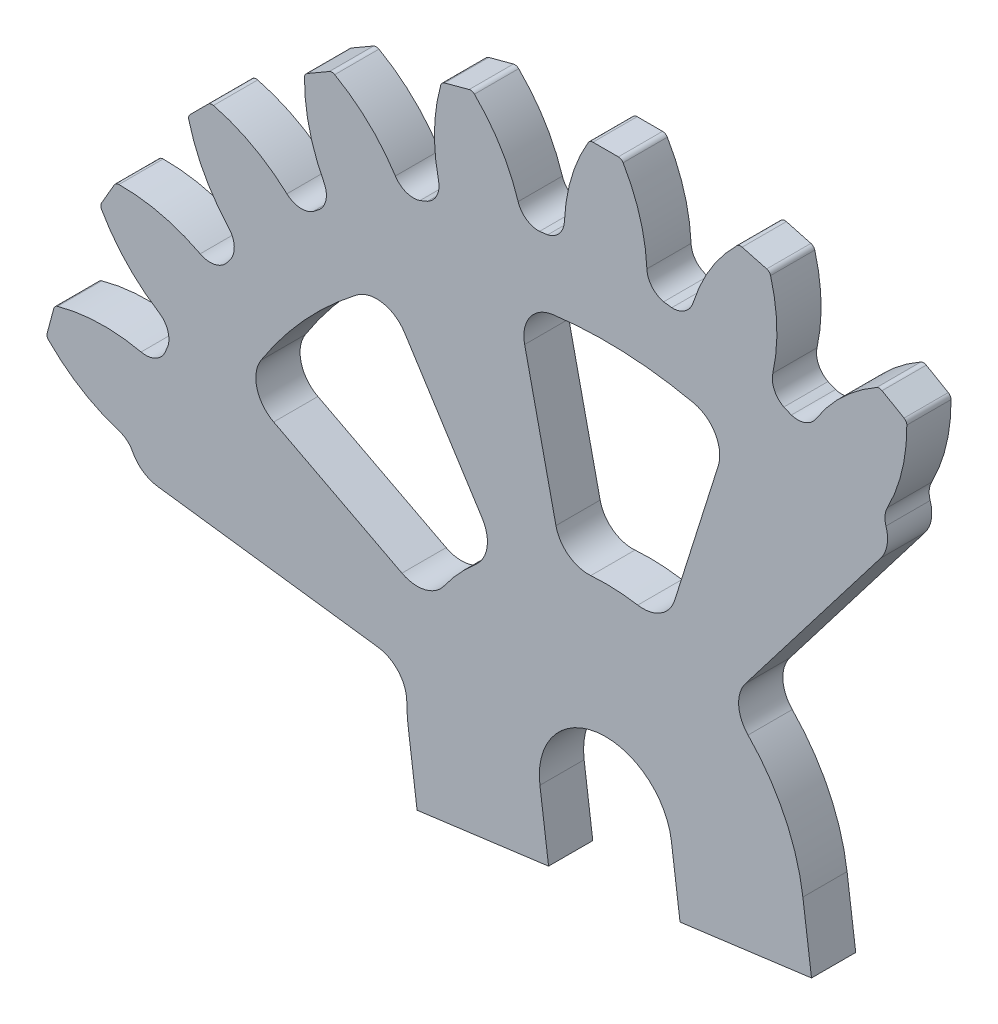
from build123d import *

# Parameters (mm, degrees)
SKETCH3_R                = 136.611351841
EXTRUDE1_DEPTH           = 12.7
EXTRUDE2_DEPTH           = 12.7
FILLET2_R                = 1.5875
CIRPATTERN1_COUNT        = 24
FILLET2_OF_CIRPATTERN1_R = 1.5875
CUT_EXTRUDE1_DEPTH       = 234.890969431
CUT_EXTRUDE1_DEPTH_BACK  = 234.890969431
CUT_EXTRUDE2_REACH       = 232.646
SKETCH5_R                = 19.05
EXTRUDE3_DEPTH           = 12.7
CUT_EXTRUDE5_DEPTH       = 231.646456089
FILLET1_R                = 9.525
CUT_EXTRUDE7_DEPTH       = 12.7


with BuildPart() as part:
    # Sketch3 → Extrude1 (new body)
    with BuildSketch(Plane.XY):
        Circle(SKETCH3_R)
    extrude(amount=EXTRUDE1_DEPTH)

    # Sketch2 → Extrude2 (add)
    with BuildSketch(Plane.XY):
        with BuildLine():
            Line((-4.546074008, 165.141901983), (4.546074008, 165.141901983))
            ThreePointArc((4.546074008, 165.141901983), (9.719017906, 153.717756782), (11.846410355, 141.35876639))
            ThreePointArc((11.846410355, 141.35876639), (13.677789854, 137.226095775), (17.83135957, 135.442622788))
            Line((17.83135957, 135.442622788), (17.83135957, 110.042622788))
            Line((17.83135957, 110.042622788), (-17.83135957, 110.042622788))
            Line((-17.83135957, 110.042622788), (-17.83135957, 135.442622788))
            ThreePointArc((-17.83135957, 135.442622788), (-13.677789854, 137.226095775), (-11.846410355, 141.35876639))
            ThreePointArc((-11.846410355, 141.35876639), (-9.719017906, 153.717756782), (-4.546074008, 165.141901983))
        make_face()
    extrude2 = extrude(amount=EXTRUDE2_DEPTH)

    # Fillet2
    fillet2_edges = [part.edges().sort_by_distance(p)[0] for p in [
        (4.546074008, 165.141901983, 6.35),
        (-4.546074008, 165.141901983, 6.35),
    ]]
    fillet(fillet2_edges, radius=FILLET2_R)

    # CirPattern1: Extrude2 ×24 about axis
    cirpattern1_axis = Axis((0, 0, 0), (0, 0, 1))
    for i in range(1, CIRPATTERN1_COUNT):
        add(extrude2.rotate(cirpattern1_axis, i * 360 / CIRPATTERN1_COUNT))

    # Fillet2 of CirPattern1
    fillet2_of_cirpattern1_edges = [part.edges().sort_by_distance(p)[0] for p in [
        (-38.350699085, 160.691438662, 6.35),
        (-47.13303967, 158.338217595, 6.35),
        (-78.633935413, 145.290119351, 6.35),
        (-86.50796657, 140.744045343, 6.35),
        (-113.558398992, 119.987518509, 6.35),
        (-119.987518509, 113.558398992, 6.35),
        (-140.744045343, 86.50796657, 6.35),
        (-145.290119351, 78.633935413, 6.35),
        (-158.338217595, 47.13303967, 6.35),
        (-160.691438662, 38.350699085, 6.35),
        (-165.141901983, 4.546074008, 6.35),
        (-165.141901983, -4.546074008, 6.35),
        (-160.691438662, -38.350699085, 6.35),
        (-158.338217595, -47.13303967, 6.35),
        (-145.290119351, -78.633935413, 6.35),
        (-140.744045343, -86.50796657, 6.35),
        (-119.987518509, -113.558398992, 6.35),
        (-113.558398992, -119.987518509, 6.35),
        (-86.50796657, -140.744045343, 6.35),
        (-78.633935413, -145.290119351, 6.35),
        (-47.13303967, -158.338217595, 6.35),
        (-38.350699085, -160.691438662, 6.35),
        (-4.546074008, -165.141901983, 6.35),
        (4.546074008, -165.141901983, 6.35),
        (38.350699085, -160.691438662, 6.35),
        (47.13303967, -158.338217595, 6.35),
        (78.633935413, -145.290119351, 6.35),
        (86.50796657, -140.744045343, 6.35),
        (113.558398992, -119.987518509, 6.35),
        (119.987518509, -113.558398992, 6.35),
        (140.744045343, -86.50796657, 6.35),
        (145.290119351, -78.633935413, 6.35),
        (158.338217595, -47.13303967, 6.35),
        (160.691438662, -38.350699085, 6.35),
        (165.141901983, -4.546074008, 6.35),
        (165.141901983, 4.546074008, 6.35),
        (160.691438662, 38.350699085, 6.35),
        (158.338217595, 47.13303967, 6.35),
        (145.290119351, 78.633935413, 6.35),
        (140.744045343, 86.50796657, 6.35),
        (119.987518509, 113.558398992, 6.35),
        (113.558398992, 119.987518509, 6.35),
        (86.50796657, 140.744045343, 6.35),
        (78.633935413, 145.290119351, 6.35),
        (47.13303967, 158.338217595, 6.35),
        (38.350699085, 160.691438662, 6.35),
    ]]
    fillet(fillet2_of_cirpattern1_edges, radius=FILLET2_OF_CIRPATTERN1_R)

    # Sketch4 → Cut-Extrude1 (cut, two sides: drawn at the far end of the back side and taken through both)
    with BuildSketch(Plane.XY.offset(-CUT_EXTRUDE1_DEPTH_BACK)):
        Polygon((-1275.53694573, 167.92762467), (-268.218413087, 35.311623982), (0, 0), (164.689969961, 214.628147505), (783.198061827, 1020.683586133), (1560.818943381, -856.6592925), (-497.916064176, -1709.415253962), align=None)
    extrude(amount=CUT_EXTRUDE1_DEPTH + CUT_EXTRUDE1_DEPTH_BACK, mode=Mode.SUBTRACT)

    # Sketch5 → Cut-Extrude2 (cut, up to next)
    with BuildSketch(Plane.XY, mode=Mode.PRIVATE) as cut_extrude2_sk1:
        Circle(SKETCH5_R)
    cut_extrude2_tool1 = extrude(cut_extrude2_sk1.sketch, amount=CUT_EXTRUDE2_REACH, mode=Mode.PRIVATE) & part.part
    add(cut_extrude2_tool1.solids().sort_by_distance((0, 0, 0))[0], mode=Mode.SUBTRACT)

    # Sketch6 → Extrude3 (add)
    with BuildSketch(Plane.XY):
        with BuildLine():
            Line((-18.887024609, -2.486523962), (-16.400500647, -21.373548571))
            Line((-16.400500647, -21.373548571), (-54.174549866, -26.346596495))
            Line((-54.174549866, -26.346596495), (-56.661073828, -7.459571885))
            ThreePointArc((-56.661073828, -7.459571885), (-57.15, 0), (-56.661073828, 7.459571885))
            Line((-56.661073828, 7.459571885), (-18.887024609, 2.486523962))
            ThreePointArc((-18.887024609, 2.486523962), (-19.05, 0), (-18.887024609, -2.486523962))
        make_face()
        with BuildLine():
            Line((11.596905223, 15.113381133), (34.790715668, 45.340143398))
            ThreePointArc((34.790715668, 45.340143398), (49.493351826, 28.575), (56.661073828, 7.459571885))
            Line((56.661073828, 7.459571885), (59.147597789, -11.427452724))
            Line((59.147597789, -11.427452724), (21.373548571, -16.400500647))
            Line((21.373548571, -16.400500647), (18.887024609, 2.486523962))
            ThreePointArc((18.887024609, 2.486523962), (16.497783942, 9.525), (11.596905223, 15.113381133))
        make_face()
    extrude(amount=EXTRUDE3_DEPTH)

    # Sketch8 → Cut-Extrude5 (cut, through all)
    with BuildSketch(Plane.XY):
        with BuildLine():
            Line((-25.426243647, 114.690373436), (-12.369523937, 55.795316807))
            ThreePointArc((-12.369523937, 55.795316807), (2.492847988, 57.095605863), (17.185336442, 54.504923735))
            Line((17.185336442, 54.504923735), (35.325413797, 112.037898789))
            ThreePointArc((35.325413797, 112.037898789), (5.124187531, 117.36318983), (-25.426243647, 114.690373436))
        make_face()
        with BuildLine():
            Line((-63.119271491, 99.077410097), (-30.706672617, 48.199821128))
            ThreePointArc((-30.706672617, 48.199821128), (-42.135399799, 38.609980365), (-50.692669116, 26.388933246))
            Line((-50.692669116, 26.388933246), (-104.201597628, 54.24391834))
            ThreePointArc((-104.201597628, 54.24391834), (-86.611655142, 79.36495964), (-63.119271491, 99.077410097))
        make_face()
    extrude(amount=CUT_EXTRUDE5_DEPTH, mode=Mode.SUBTRACT)

    # Fillet1
    fillet1_edges = [part.edges().sort_by_distance(p)[0] for p in [
        (34.790715668, 45.340143398, 6.35),
        (-50.692669116, 26.388933246, 6.35),
        (-30.706672617, 48.199821128, 6.35),
        (-63.119271491, 99.077410097, 6.35),
        (-104.201597628, 54.24391834, 6.35),
        (-12.369523937, 55.795316807, 6.35),
        (17.185336442, 54.504923735, 6.35),
        (35.325413797, 112.037898789, 6.35),
        (-25.426243647, 114.690373436, 6.35),
        (-56.661073828, 7.459571885, 6.35),
    ]]
    fillet(fillet1_edges, radius=FILLET1_R)

    # Sketch9 → Cut-Extrude7 (cut)
    with BuildSketch(Plane.XY):
        with BuildLine():
            Line((79.034097122, 102.999240689), (83.809524096, 109.222698287))
            Line((83.809524096, 109.222698287), (80.539107883, 111.732176909))
            ThreePointArc((80.539107883, 111.732176909), (80.864034333, 107.180027092), (79.034097122, 102.999240689))
        make_face()
        with BuildLine():
            Line((-128.717007568, 16.945915528), (-136.494393434, 17.969827802))
            Line((-136.494393434, 17.969827802), (-135.956329304, 22.056830634))
            ThreePointArc((-135.956329304, 22.056830634), (-132.967230996, 18.608216933), (-128.717007568, 16.945915528))
        make_face()
    extrude(amount=CUT_EXTRUDE7_DEPTH, mode=Mode.SUBTRACT)


solid = part.part
